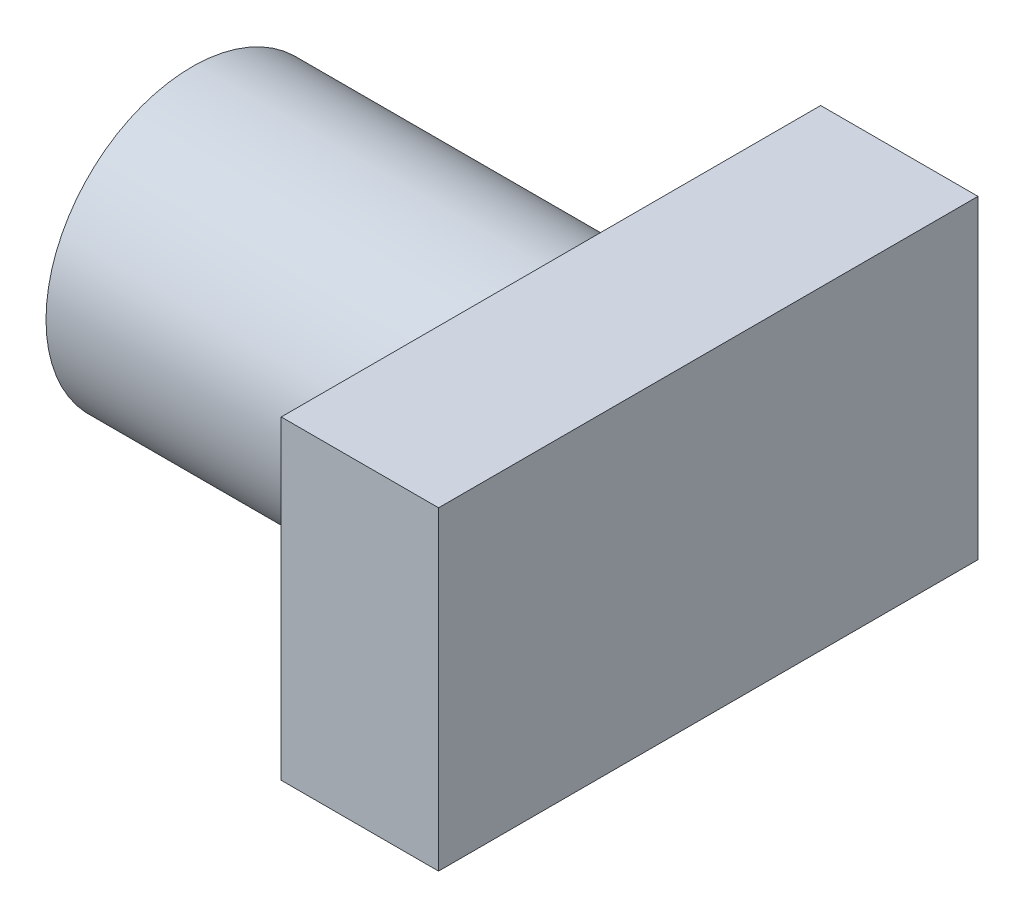
from build123d import *

# Parameters (mm, degrees)
SKETCH1_W           = 35
SKETCH1_H           = 120
BOSS_EXTRUDE1_DEPTH = 70
SKETCH2_R           = 32.5
BOSS_EXTRUDE2_DEPTH = 80
SKETCH3_R           = 3.175
CUT_EXTRUDE1_DEPTH  = 10


with BuildPart() as part:
    # Sketch1 → Boss-Extrude1 (new body)
    with BuildSketch(Plane(origin=(0, 0, 0), x_dir=(1, 0, 0), z_dir=(0, 1, 0))):
        with Locations((17.5, 60)):
            Rectangle(SKETCH1_W, SKETCH1_H)
    extrude(amount=BOSS_EXTRUDE1_DEPTH)

    # Sketch2 → Boss-Extrude2 (add)
    with BuildSketch(Plane.ZY):
        with Locations((-60.174932569, 34.890792619)):
            Circle(SKETCH2_R)
    extrude(amount=BOSS_EXTRUDE2_DEPTH)

    # Sketch3 → Cut-Extrude1 (cut)
    with BuildSketch(Plane.XZ):
        with Locations(Location((17.432872718, -60.623445189, 0), (0, 0, 270))):
            Circle(SKETCH3_R)
    extrude(amount=-CUT_EXTRUDE1_DEPTH, mode=Mode.SUBTRACT)


solid = part.part
